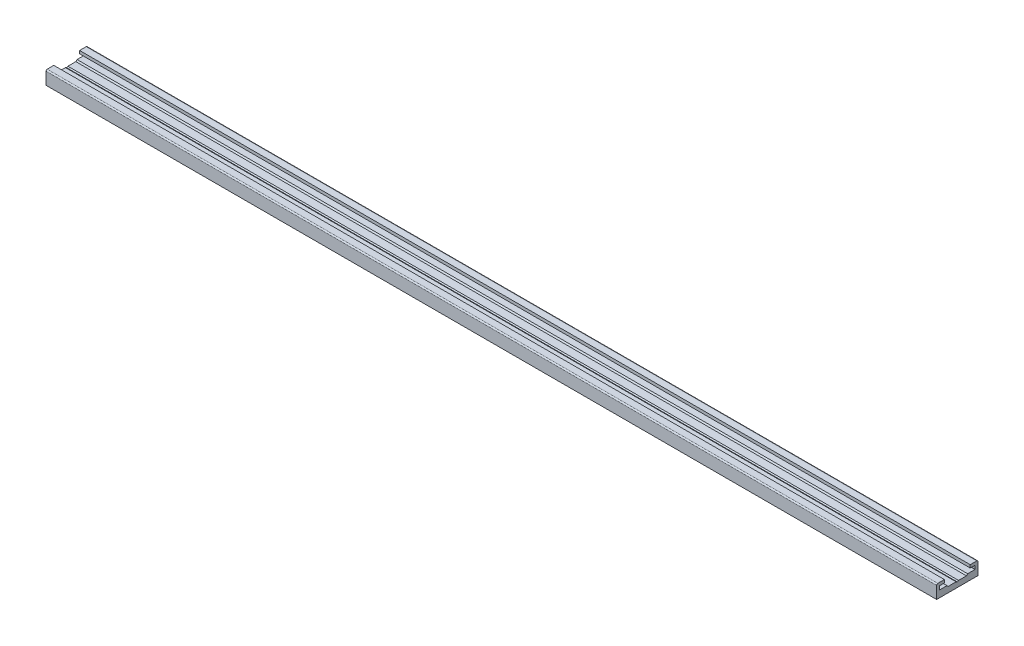
from build123d import *

# Parameters (mm, degrees)
BOSS_EXTRUDE1_DEPTH = 366


with BuildPart() as part:
    # Sketch5 → Boss-Extrude1 (new body)
    with BuildSketch(Plane(origin=(0, 0, 0), x_dir=(0, 0, -1), z_dir=(1, 0, 0))):
        with BuildLine():
            Line((-8.499999996, -2.75), (8.499999996, -2.75))
            Line((8.499999996, -2.75), (8.499999996, 2.25))
            ThreePointArc((8.499999996, 2.25), (8.353553387, 2.603553391), (7.999999996, 2.75))
            Line((7.999999996, 2.75), (5.299999996, 2.75))
            Line((5.299999996, 2.75), (5.299999996, 1.55))
            Line((5.299999996, 1.55), (7.299999998, 1.55))
            Line((7.299999998, 1.55), (7.299999998, 0.05))
            Line((7.299999998, 0.05), (4.249999998, 0.05))
            Line((4.249999998, 0.05), (3.749999998, -0.45))
            Line((3.749999998, -0.45), (0.499999998, -0.45))
            Line((0.499999998, -0.45), (0, -0.738675133))
            Line((0, -0.738675133), (-0.499999998, -0.45))
            Line((-0.499999998, -0.45), (-3.749999998, -0.45))
            Line((-3.749999998, -0.45), (-4.249999998, 0.05))
            Line((-4.249999998, 0.05), (-7.299999998, 0.05))
            Line((-7.299999998, 0.05), (-7.299999998, 1.55))
            Line((-7.299999998, 1.55), (-5.299999996, 1.55))
            Line((-5.299999996, 1.55), (-5.299999996, 2.75))
            Line((-5.299999996, 2.75), (-7.999999996, 2.75))
            ThreePointArc((-7.999999996, 2.75), (-8.353553387, 2.603553391), (-8.499999996, 2.25))
            Line((-8.499999996, 2.25), (-8.499999996, -2.75))
        make_face()
    extrude(amount=BOSS_EXTRUDE1_DEPTH)


solid = part.part
